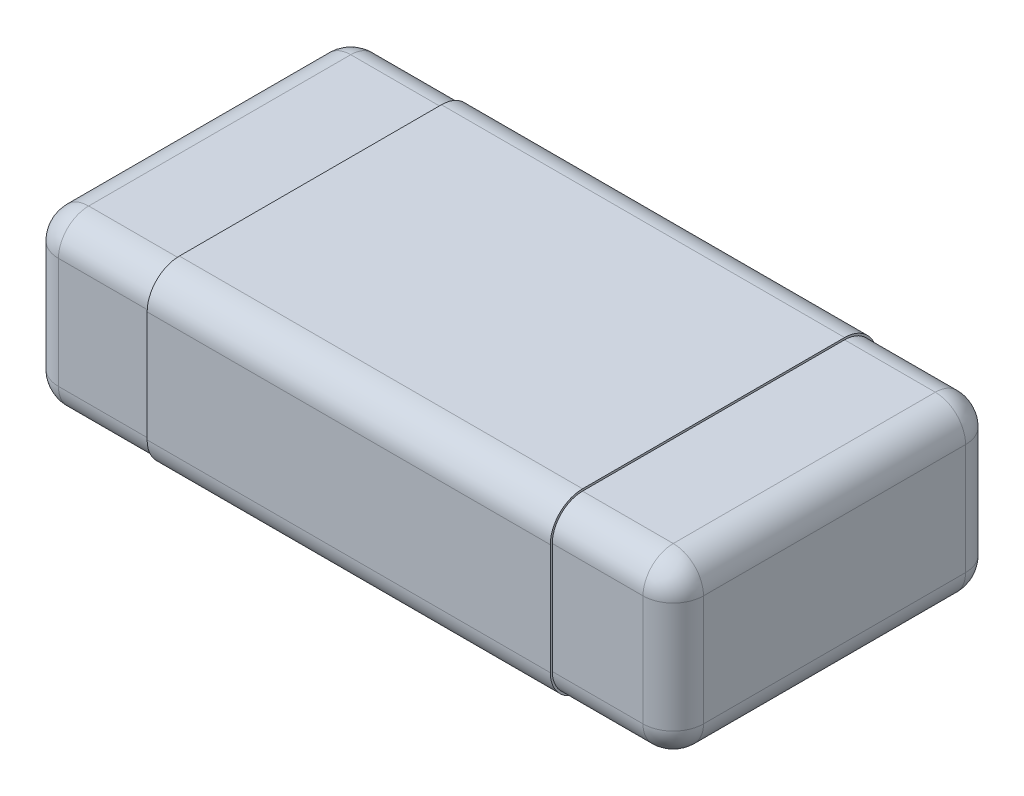
from build123d import *

# Parameters (mm, degrees)
ESBO_O1_W                     = 3.2
ESBO_O1_H                     = 1.6
RESSALTO_EXTRUS_O1_DEPTH      = 0.85
FILETE1_R                     = 0.15
RESSALTO_EXTRUS_O4_DEPTH      = 1
RESSALTO_EXTRUS_O4_DEPTH_BACK = 1


with BuildPart() as part:
    # Esboço1 → Ressalto-extrusão1 (new body)
    with BuildSketch(Plane(origin=(0, 0, 0), x_dir=(1, 0, 0), z_dir=(0, 1, 0))):
        with Locations((0.6, 0.175)):
            Rectangle(ESBO_O1_W, ESBO_O1_H)
    extrude(amount=-RESSALTO_EXTRUS_O1_DEPTH)

    # Filete1
    filete1_edges = [part.edges().sort_by_distance(p)[0] for p in [
        (2.2, -0.85, -0.175),
        (0.6, -0.85, -0.975),
        (-1, -0.85, -0.175),
        (0.6, 0, -0.975),
        (2.2, 0, -0.175),
        (0.6, 0, 0.625),
        (-1, 0, -0.175),
        (0.6, -0.85, 0.625),
        (-1, -0.425, -0.975),
        (2.2, -0.425, -0.975),
        (2.2, -0.425, 0.625),
        (-1, -0.425, 0.625),
    ]]
    fillet(filete1_edges, radius=FILETE1_R)

    # Esboço4 → Ressalto-extrusão4 (add, two sides: drawn at the far end of the back side and taken through both)
    with BuildSketch(Plane(origin=(0.6, 0, 0), x_dir=(0, 0, -1), z_dir=(1, 0, 0)).offset(-RESSALTO_EXTRUS_O4_DEPTH_BACK)):
        with BuildLine():
            Line((0.985, -0.7), (0.985, -0.15))
            ThreePointArc((0.985, -0.15), (0.938137085, -0.036862915), (0.825, 0.01))
            Line((0.825, 0.01), (-0.475, 0.01))
            ThreePointArc((-0.475, 0.01), (-0.588137085, -0.036862915), (-0.635, -0.15))
            Line((-0.635, -0.15), (-0.635, -0.7))
            ThreePointArc((-0.635, -0.7), (-0.588137085, -0.813137085), (-0.475, -0.86))
            Line((-0.475, -0.86), (0.825, -0.86))
            ThreePointArc((0.825, -0.86), (0.938137085, -0.813137085), (0.985, -0.7))
        make_face()
        with BuildLine():
            Line((0.975, -0.7), (0.975, -0.15))
            ThreePointArc((0.975, -0.15), (0.931066017, -0.043933983), (0.825, 0))
            Line((0.825, 0), (-0.475, 0))
            ThreePointArc((-0.475, 0), (-0.581066017, -0.043933983), (-0.625, -0.15))
            Line((-0.625, -0.15), (-0.625, -0.7))
            ThreePointArc((-0.625, -0.7), (-0.581066017, -0.806066017), (-0.475, -0.85))
            Line((-0.475, -0.85), (0.825, -0.85))
            ThreePointArc((0.825, -0.85), (0.931066017, -0.806066017), (0.975, -0.7))
        make_face(mode=Mode.SUBTRACT)
    extrude(amount=RESSALTO_EXTRUS_O4_DEPTH + RESSALTO_EXTRUS_O4_DEPTH_BACK)


solid = part.part
